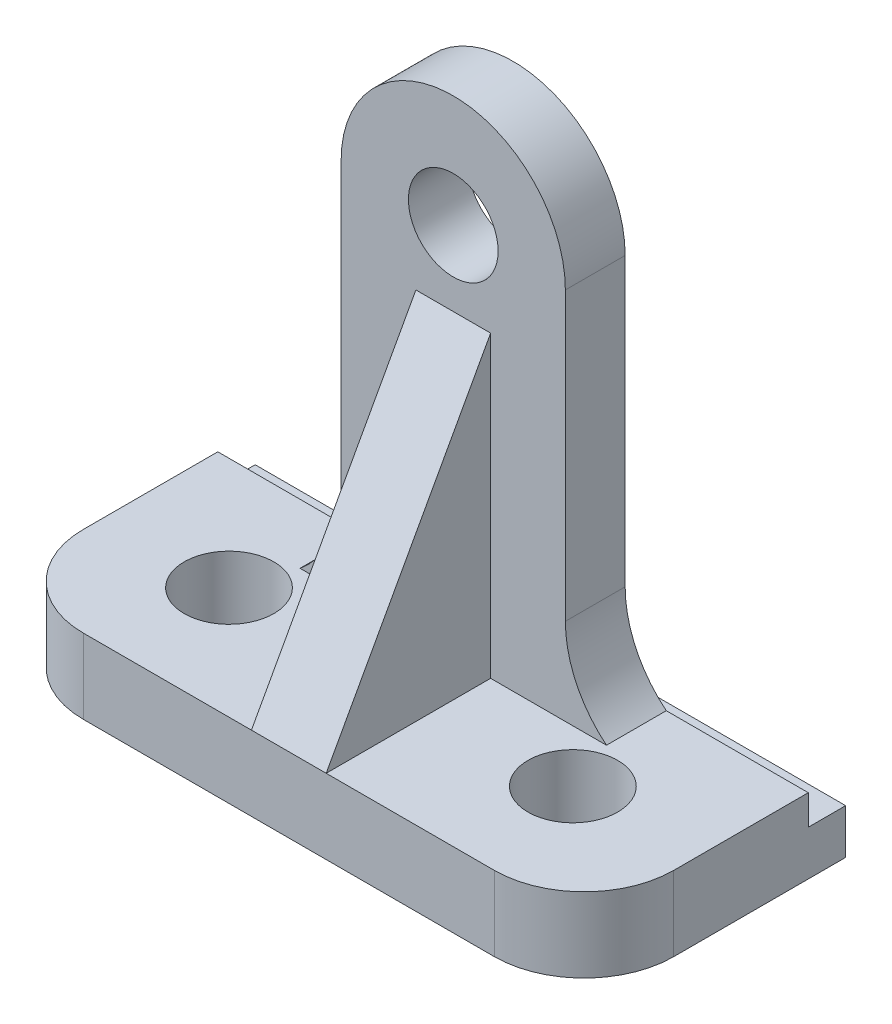
from build123d import *

# Parameters (mm, degrees)
BOSS_EXTRUDE1_DEPTH     = 10
SKETCH2_W               = 5
SKETCH2_H               = 4
CUT_EXTRUDE1_DEPTH      = 79
BOSS_EXTRUDE2_DEPTH     = 13
CUT_EXTRUDE2_DEPTH      = 100.097174531
CUT_EXTRUDE2_DEPTH_BACK = 100.097174531
SKETCH6_W               = 5
SKETCH6_H               = 65
SKETCH7_R               = 6
CUT_EXTRUDE3_DEPTH      = 13
RIB1_REACH              = 93.707
SKETCH8_WALL_W          = 231.065679212
SKETCH8_WALL_H          = 10
SKETCH9_R               = 6
CUT_EXTRUDE4_DEPTH      = 13


with BuildPart() as part:
    # Sketch1 → Boss-Extrude1 (new body)
    with BuildSketch(Plane(origin=(0, 0, 0), x_dir=(1, 0, 0), z_dir=(0, 1, 0))):
        with BuildLine():
            Line((-39.5, 0), (39.5, 0))
            Line((39.5, 0), (39.5, -23))
            ThreePointArc((39.5, -23), (35.985281374, -31.485281374), (27.5, -35))
            Line((27.5, -35), (-27.5, -35))
            ThreePointArc((-27.5, -35), (-35.985281374, -31.485281374), (-39.5, -23))
            Line((-39.5, -23), (-39.5, 0))
        make_face()
    extrude(amount=BOSS_EXTRUDE1_DEPTH)

    # Sketch2 → Cut-Extrude1 (cut)
    with BuildSketch(Plane(origin=(39.5, 0, 0), x_dir=(0, 0, -1), z_dir=(1, 0, 0))):
        with Locations((-2.5, 8)):
            Rectangle(SKETCH2_W, SKETCH2_H)
    extrude(amount=-CUT_EXTRUDE1_DEPTH, mode=Mode.SUBTRACT)

    # Sketch5 → Boss-Extrude2 (add)
    with BuildSketch(Plane.XY):
        with BuildLine():
            Line((-15, 60), (-15, 21.608186766))
            ThreePointArc((-15, 21.608186766), (-16.444558288, 15.185570477), (-20.5, 10))
            Line((-20.5, 10), (20.5, 10))
            ThreePointArc((20.5, 10), (16.444558288, 15.185570477), (15, 21.608186766))
            Line((15, 21.608186766), (15, 60))
            ThreePointArc((15, 60), (0, 75), (-15, 60))
        make_face()
    extrude(amount=BOSS_EXTRUDE2_DEPTH)

    # Sketch6 → Cut-Extrude2 (cut, two sides: drawn at the far end of the back side and taken through both)
    with BuildSketch(Plane(origin=(15, 0, 0), x_dir=(0, 0, -1), z_dir=(1, 0, 0)).offset(-CUT_EXTRUDE2_DEPTH_BACK)):
        with Locations((-2.5, 42.5)):
            Rectangle(SKETCH6_W, SKETCH6_H)
    extrude(amount=CUT_EXTRUDE2_DEPTH + CUT_EXTRUDE2_DEPTH_BACK, mode=Mode.SUBTRACT)

    # Sketch7 → Cut-Extrude3 (cut)
    with BuildSketch(Plane.XY.offset(13)):
        with Locations((0, 60)):
            Circle(SKETCH7_R)
    extrude(amount=-CUT_EXTRUDE3_DEPTH, mode=Mode.SUBTRACT)

    # Sketch8 wall → Rib1 (add, up to next)
    with BuildSketch(Plane(origin=(0, 30, 24), x_dir=(0, 0.876215908677, -0.481918749772), z_dir=(0, 0.481918749772, 0.876215908677)), mode=Mode.PRIVATE) as rib1_sk1:
        Rectangle(SKETCH8_WALL_W, SKETCH8_WALL_H)
    rib1_tool1 = extrude(rib1_sk1.sketch, amount=-RIB1_REACH, mode=Mode.PRIVATE) - part.part
    add(rib1_tool1.solids().sort_by_distance((0, 30, 24))[0])

    # Sketch9 → Cut-Extrude4 (cut)
    with BuildSketch(Plane(origin=(0, 10, 0), x_dir=(1, 0, 0), z_dir=(0, 1, 0))):
        with Locations(Location((23, -20, 0), (0, 0, 270))):
            Circle(SKETCH9_R)
        with Locations(Location((-23, -20, 0), (0, 0, 270))):
            Circle(SKETCH9_R)
    extrude(amount=-CUT_EXTRUDE4_DEPTH, mode=Mode.SUBTRACT)


solid = part.part
